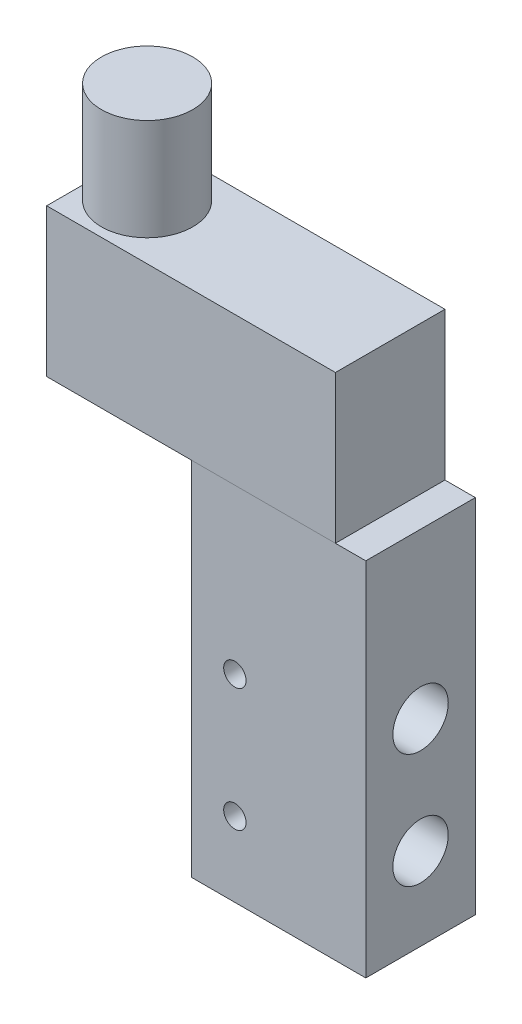
from build123d import *

# Parameters (mm, degrees)
SKETCH1_W                         = 35
SKETCH1_H                         = 72.57
BOSS_EXTRUDE1_DEPTH               = 22
SKETCH2_W                         = 58
SKETCH2_H                         = 22
BOSS_EXTRUDE2_DEPTH               = 29.71
SKETCH3_R                         = 9.175
BOSS_EXTRUDE3_DEPTH               = 50.11
M4_CLEARANCE_HOLE1_D              = 4.5
PIPE_TAP_DRILL_FOR_1_4_TAP1_D     = 11.1252
PIPE_TAP_DRILL_FOR_1_4_TAP1_DEPTH = 15
PIPE_TAP_DRILL_FOR_1_4_TAP1_TIP   = 3.342347279
PIPE_TAP_DRILL_FOR_1_4_TAP2_D     = 11.1252
PIPE_TAP_DRILL_FOR_1_4_TAP2_DEPTH = 15
PIPE_TAP_DRILL_FOR_1_4_TAP2_TIP   = 3.342347279


with BuildPart() as part:
    # Sketch1 → Boss-Extrude1 (new body)
    with BuildSketch(Plane.XY):
        Rectangle(SKETCH1_W, SKETCH1_H)
    extrude(amount=BOSS_EXTRUDE1_DEPTH)

    # Sketch2 → Boss-Extrude2 (add)
    with BuildSketch(Plane(origin=(0, 36.285, 0), x_dir=(1, 0, 0), z_dir=(0, 1, 0))):
        with Locations((-17.6, -11)):
            Rectangle(SKETCH2_W, SKETCH2_H)
    extrude(amount=BOSS_EXTRUDE2_DEPTH)

    # Sketch3 → Boss-Extrude3 (add)
    with BuildSketch(Plane.XZ.offset(-36.285)):
        with Locations((-37.425, 11)):
            Circle(SKETCH3_R)
    extrude(amount=-BOSS_EXTRUDE3_DEPTH)

    # M4 Clearance Hole1 (through all)
    with Locations(Plane.XY.offset(22)):
        with Locations((-8.8, 3.415), (-8.8, -21.285)):
            Hole(M4_CLEARANCE_HOLE1_D / 2)

    # Pipe Tap Drill for 1/4 Tap1
    with Locations(Plane.ZY.offset(17.5)):
        with Locations((11, -7.985)):
            Hole(PIPE_TAP_DRILL_FOR_1_4_TAP1_D / 2, depth=PIPE_TAP_DRILL_FOR_1_4_TAP1_DEPTH)
            with Locations((0, 0, -(PIPE_TAP_DRILL_FOR_1_4_TAP1_DEPTH + PIPE_TAP_DRILL_FOR_1_4_TAP1_TIP / 2))):  # 118° drill point
                Cone(0, PIPE_TAP_DRILL_FOR_1_4_TAP1_D / 2, PIPE_TAP_DRILL_FOR_1_4_TAP1_TIP, mode=Mode.SUBTRACT)

    # Pipe Tap Drill for 1/4 Tap2
    with Locations(Plane(origin=(17.5, 0, 0), x_dir=(0, 0, -1), z_dir=(1, 0, 0))):
        with Locations((-11, 3.315), (-11, -19.685)):
            Hole(PIPE_TAP_DRILL_FOR_1_4_TAP2_D / 2, depth=PIPE_TAP_DRILL_FOR_1_4_TAP2_DEPTH)
            with Locations((0, 0, -(PIPE_TAP_DRILL_FOR_1_4_TAP2_DEPTH + PIPE_TAP_DRILL_FOR_1_4_TAP2_TIP / 2))):  # 118° drill point
                Cone(0, PIPE_TAP_DRILL_FOR_1_4_TAP2_D / 2, PIPE_TAP_DRILL_FOR_1_4_TAP2_TIP, mode=Mode.SUBTRACT)


solid = part.part
